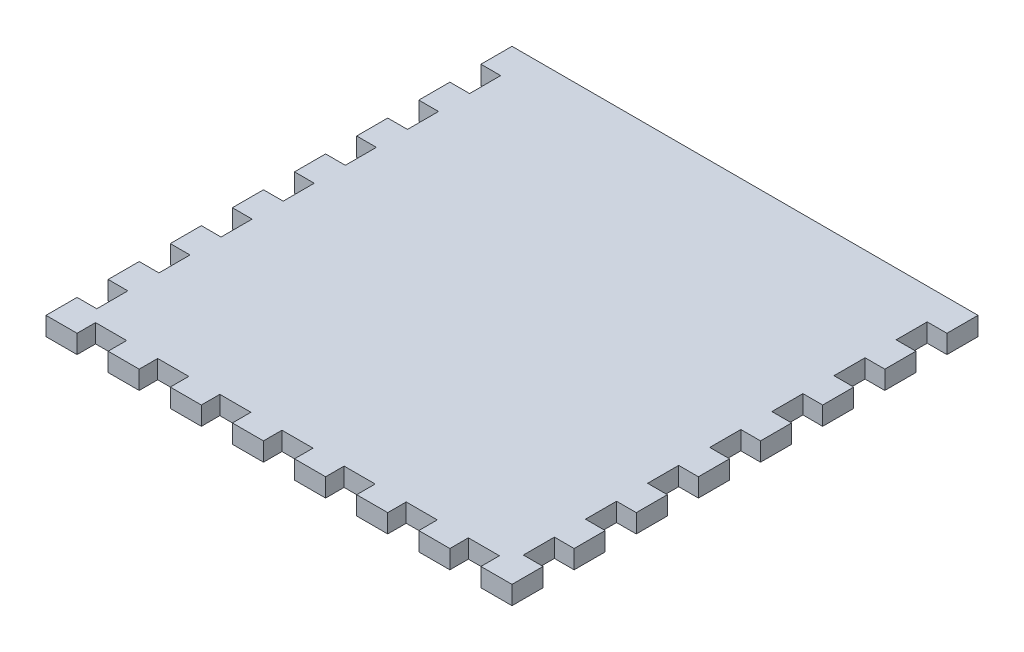
from build123d import *

# Parameters (mm, degrees)
SKETCH1_W           = 80
SKETCH1_H           = 80
BOSS_EXTRUDE1_DEPTH = 3.175
SKETCH3_OUTSIDE_W   = 104.636
SKETCH3_OUTSIDE_H   = 104.636
CUT_EXTRUDE1_DEPTH  = 57.657573413
SKETCH8_W           = 80
SKETCH8_H           = 5.333333333
BOSS_EXTRUDE2_DEPTH = 3.175


with BuildPart() as part:
    # Sketch1 → Boss-Extrude1 (new body)
    with BuildSketch(Plane(origin=(0, 0, 0), x_dir=(1, 0, 0), z_dir=(0, 1, 0))):
        Rectangle(SKETCH1_W, SKETCH1_H)
    extrude(amount=BOSS_EXTRUDE1_DEPTH)

    # Sketch3 outside → Cut-Extrude1 (cut, through all)
    with BuildSketch(Plane(origin=(0, 3.175, 0), x_dir=(1, 0, 0), z_dir=(0, 1, 0))):
        Rectangle(SKETCH3_OUTSIDE_W, SKETCH3_OUTSIDE_H)
        Polygon((-40, -40), (-34.666666667, -40), (-34.666666667, -36.825), (-29.333333333, -36.825), (-29.333333333, -40), (-24, -40), (-24, -36.825), (-18.666666667, -36.825), (-18.666666667, -40), (-13.333333333, -40), (-13.333333333, -36.825), (-8, -36.825), (-8, -40), (-2.666666667, -40), (-2.666666667, -36.825), (2.666666667, -36.825), (2.666666667, -40), (8, -40), (8, -36.825), (13.333333333, -36.825), (13.333333333, -40), (18.666666667, -40), (18.666666667, -36.825), (24, -36.825), (24, -40), (29.333333333, -40), (29.333333333, -36.825), (34.666666667, -36.825), (34.666666667, -40), (40, -40), (40, -34.666666667), (36.613333333, -34.666666667), (36.613333333, -29.333333333), (40, -29.333333333), (40, -24), (36.613333333, -24), (36.613333333, -18.666666667), (40, -18.666666667), (40, -13.333333333), (36.613333333, -13.333333333), (36.613333333, -8), (40, -8), (40, -2.666666667), (36.613333333, -2.666666667), (36.613333333, 2.666666667), (40, 2.666666667), (40, 8), (36.613333333, 8), (36.613333333, 13.333333333), (40, 13.333333333), (40, 18.666666667), (36.613333333, 18.666666667), (36.613333333, 24), (40, 24), (40, 29.333333333), (36.613333333, 29.333333333), (36.613333333, 34.666666667), (40, 34.666666667), (40, 40), (34.666666667, 40), (34.666666667, 36.825), (29.333333333, 36.825), (29.333333333, 40), (24, 40), (24, 36.825), (18.666666667, 36.825), (18.666666667, 40), (13.333333333, 40), (13.333333333, 36.825), (8, 36.825), (8, 40), (2.666666667, 40), (2.666666667, 36.825), (-2.666666667, 36.825), (-2.666666667, 40), (-8, 40), (-8, 36.825), (-13.333333333, 36.825), (-13.333333333, 40), (-18.666666667, 40), (-18.666666667, 36.825), (-24, 36.825), (-24, 40), (-29.333333333, 40), (-29.333333333, 36.825), (-34.666666667, 36.825), (-34.666666667, 40), (-40, 40), (-40, 34.666666667), (-36.613333333, 34.666666667), (-36.613333333, 29.333333333), (-40, 29.333333333), (-40, 24), (-36.613333333, 24), (-36.613333333, 18.666666667), (-40, 18.666666667), (-40, 13.333333333), (-36.613333333, 13.333333333), (-36.613333333, 8), (-40, 8), (-40, 2.666666667), (-36.613333333, 2.666666667), (-36.613333333, -2.666666667), (-40, -2.666666667), (-40, -8), (-36.613333333, -8), (-36.613333333, -13.333333333), (-40, -13.333333333), (-40, -18.666666667), (-36.613333333, -18.666666667), (-36.613333333, -24), (-40, -24), (-40, -29.333333333), (-36.613333333, -29.333333333), (-36.613333333, -34.666666667), (-40, -34.666666667), align=None, mode=Mode.SUBTRACT)
    extrude(amount=-CUT_EXTRUDE1_DEPTH, mode=Mode.SUBTRACT)

    # Sketch8 → Boss-Extrude2 (add)
    with BuildSketch(Plane(origin=(0, 3.175, 0), x_dir=(1, 0, 0), z_dir=(0, 1, 0))):
        with Locations((0, 37.333333334)):
            Rectangle(SKETCH8_W, SKETCH8_H)
    extrude(amount=-BOSS_EXTRUDE2_DEPTH)


solid = part.part
